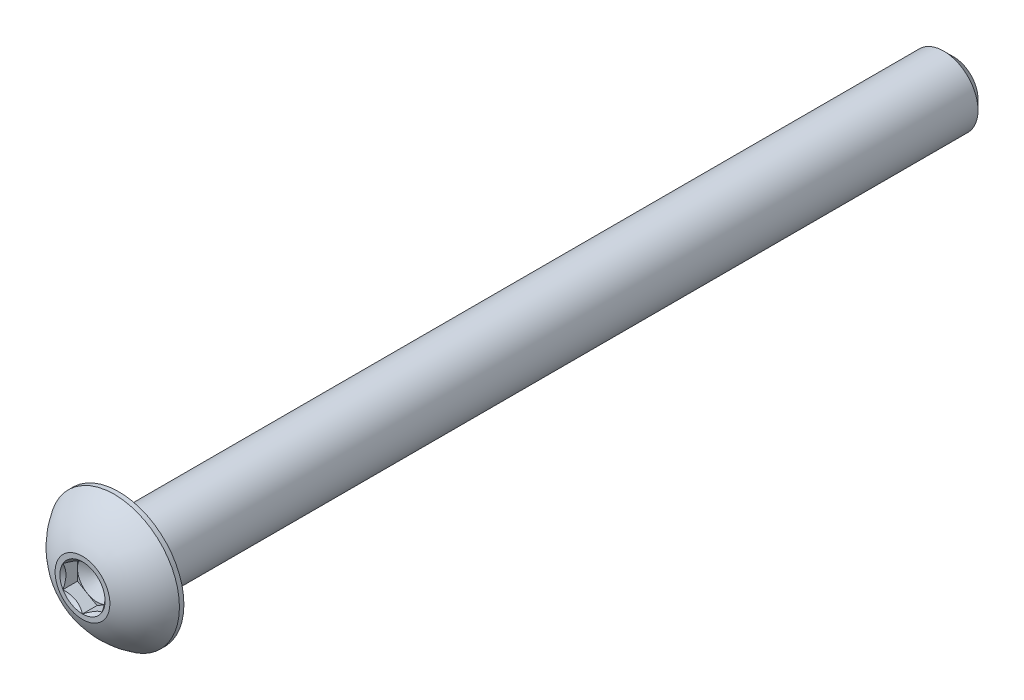
from build123d import *

# Parameters (mm, degrees)
CUT_EXTRUDE1_START = 25.62098
CUT_EXTRUDE1_DEPTH = 2.469810899


with BuildPart() as part:
    # Sketch2 → Revolve1 (revolve)
    with BuildSketch(Plane(origin=(0, 0, 0), x_dir=(0, 0, -1), z_dir=(1, 0, 0)), mode=Mode.PRIVATE) as revolve1_sk:
        with BuildLine():
            Line((-26.5049, 1.190625), (-26.5049, 1.666875))
            ThreePointArc((-26.5049, 1.666875), (-25.728079378, 2.976711786), (-24.567242857, 3.9624))
            Line((-24.567242857, 3.9624), (-24.2951, 3.9624))
            Line((-24.2951, 3.9624), (-24.2951, 2.0828))
            Line((-24.2951, 2.0828), (25.9095875, 2.0828))
            Line((25.9095875, 2.0828), (26.5049, 1.4874875))
            Line((26.5049, 1.4874875), (26.5049, 0))
            Line((26.5049, 0), (-24.933572336, 0))
            Line((-24.933572336, 0), (-25.62098, 1.190625))
            Line((-25.62098, 1.190625), (-26.5049, 1.190625))
        make_face()
    revolve(revolve1_sk.sketch.rotate(Axis((0, 0, 26.5049), (0, 0, -1)), 90), axis=Axis((0, 0, 26.5049), (0, 0, -1)))

    # Sketch3 → Cut-Extrude1 (cut, through all)
    with BuildSketch(Plane.XY.offset(CUT_EXTRUDE1_START)):
        Polygon((0, 1.374815329), (-1.190625, 0.687407664), (-1.190625, -0.687407664), (0, -1.374815329), (1.190625, -0.687407664), (1.190625, 0.687407664), align=None)
    extrude(amount=CUT_EXTRUDE1_DEPTH, mode=Mode.SUBTRACT)

    # Cut-Extrude2 cone 1 section (through the dimple's axis) → Cut-Extrude2 (revolve, cut)
    with BuildSketch(Plane(origin=(0, 0, 26.5049), x_dir=(0, -1, 0), z_dir=(1, 0, 0))):
        Polygon((0, 0), (1.374815329, 0), (0, 1.374815329), align=None)
    revolve(axis=Axis((0, 0, 26.5049), (0, 0, -1)), mode=Mode.SUBTRACT)


solid = part.part
